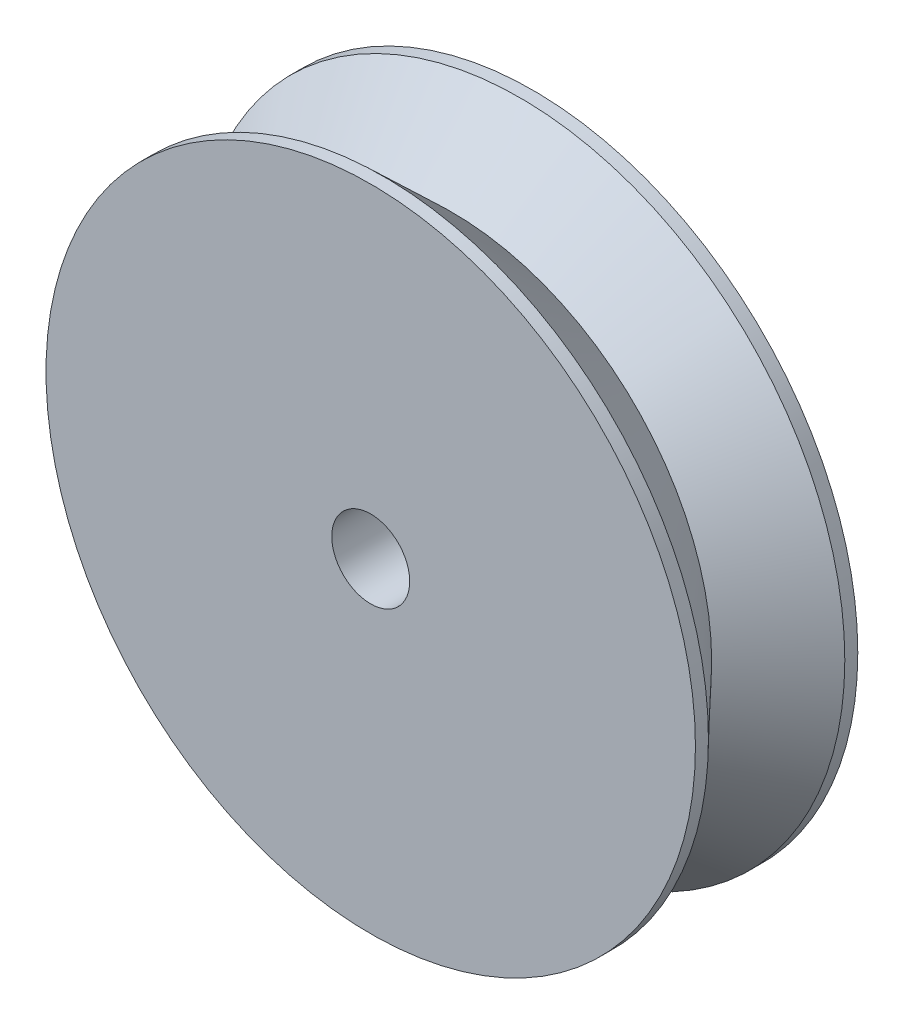
from build123d import *

# Parameters (mm, degrees)
SKETCH3_R          = 1.524
CUT_EXTRUDE1_DEPTH = 20.05


with BuildPart() as part:
    # Sketch1 → Revolve1 (revolve)
    with BuildSketch(Plane(origin=(0, 0, 0), x_dir=(0, 0, -1), z_dir=(1, 0, 0)), mode=Mode.PRIVATE) as revolve1_sk:
        Polygon((0, 0), (6.35, 0), (6.35, 12.7), (5.842, 12.7), (3.175, 10.16), (0.508, 12.7), (0, 12.7), align=None)
    revolve(revolve1_sk.sketch.rotate(Axis((0, 0, 0), (0, 0, -1)), 90), axis=Axis((0, 0, 0), (0, 0, -1)))

    # Sketch3 → Cut-Extrude1 (cut, through all)
    with BuildSketch(Plane.XY):
        Circle(SKETCH3_R)
    extrude(amount=-CUT_EXTRUDE1_DEPTH, mode=Mode.SUBTRACT)


solid = part.part
